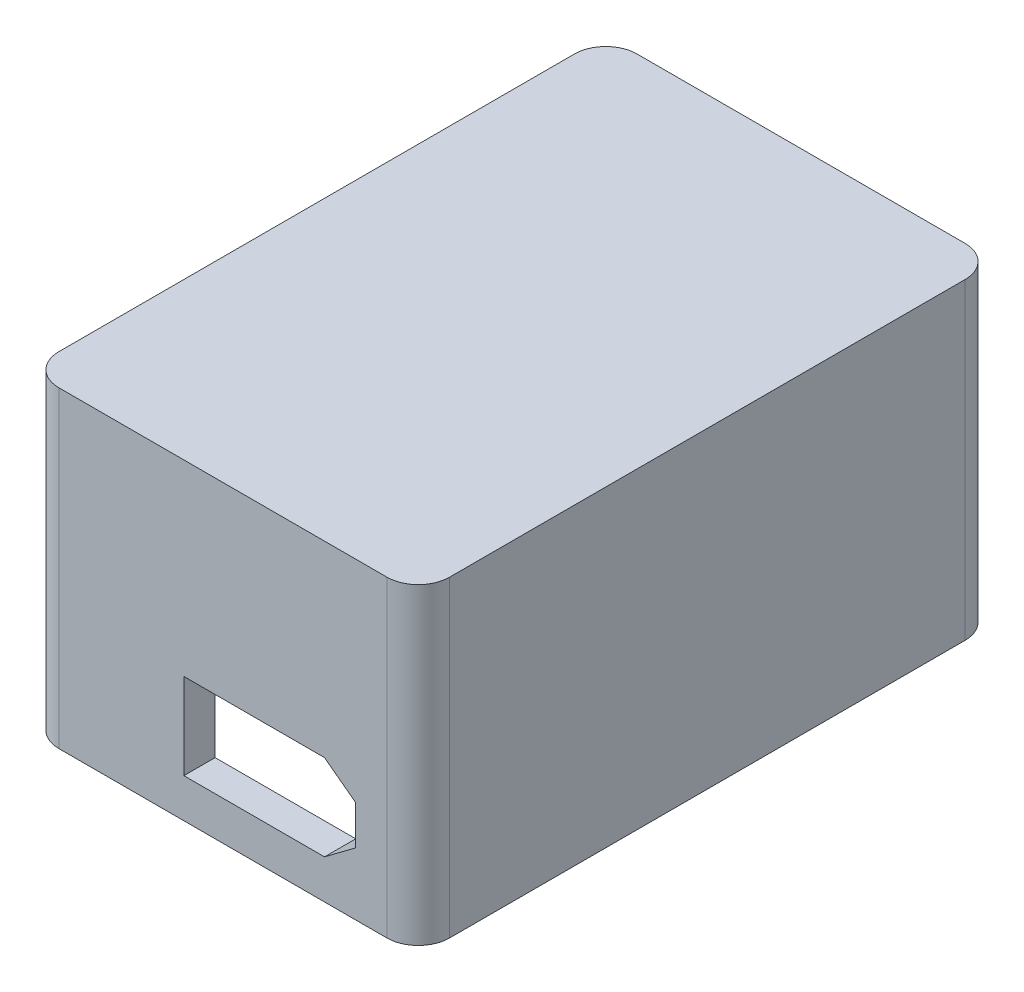
from build123d import *

# Parameters (mm, degrees)
SKETCH_1_W          = 25
SKETCH_1_H          = 37
EXTRUDE_1_DEPTH     = 20
SHELL_1_T           = -2
FILLET_1_R          = 2
CUT_EXTRUDE_1_DEPTH = 43.20485754
CUT_EXTRUDE_2_DEPTH = 43.20485754


with BuildPart() as part:
    # 草图1 → 凸台-拉伸1 (new body)
    with BuildSketch(Plane(origin=(0, 0, 0), x_dir=(1, 0, 0), z_dir=(0, 1, 0))):
        Rectangle(SKETCH_1_W, SKETCH_1_H)
    extrude(amount=EXTRUDE_1_DEPTH)

    # 抽壳1
    shell_1_openings = [part.faces().sort_by_distance(p)[0] for p in [
        (0, 0, 0),
    ]]
    offset(amount=SHELL_1_T, openings=shell_1_openings, kind=Kind.INTERSECTION)

    # 圆角1
    fillet_1_edges = [part.edges().sort_by_distance(p)[0] for p in [
        (-12.5, 10, 18.5),
        (12.5, 10, 18.5),
        (-12.5, 10, -18.5),
        (12.5, 10, -18.5),
    ]]
    fillet(fillet_1_edges, radius=FILLET_1_R)

    # 草图3 → 切除-拉伸1 (cut, through all)
    with BuildSketch(Plane(origin=(0, 0, 16.5), x_dir=(-1, 0, 0), z_dir=(0, 0, -1))):
        Polygon((2.5, 8), (-6.5, 8), (-8.5, 6.5), (-8.5, 4), (-6.5, 2.5), (2.5, 2.5), align=None)
    extrude(amount=-CUT_EXTRUDE_1_DEPTH, mode=Mode.SUBTRACT)

    # 草图3<3> → 切除-拉伸2 (cut, through all)
    with BuildSketch(Plane(origin=(0, 0, 16.5), x_dir=(-1, 0, 0), z_dir=(0, 0, -1))):
        with BuildLine():
            Line((3.5, 13), (-3.5, 13))
            ThreePointArc((-3.5, 13), (-5.1, 11.4), (-3.5, 9.8))
            Line((-3.5, 9.8), (3.5, 9.8))
            ThreePointArc((3.5, 9.8), (5.1, 11.4), (3.5, 13))
        make_face()
    extrude(amount=CUT_EXTRUDE_2_DEPTH, mode=Mode.SUBTRACT)


solid = part.part
